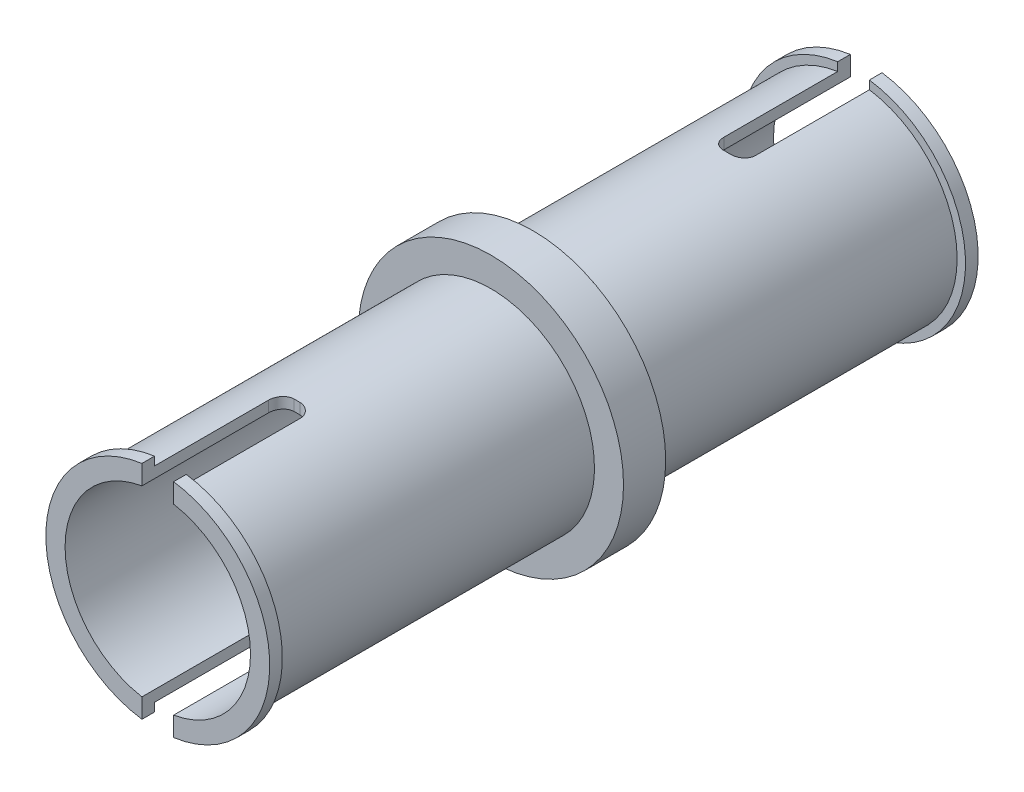
from build123d import *

# Parameters (mm, degrees)
BOSS_EXTRUDE1_DEPTH = 7.9
SKETCH2_R           = 3.144549921
BOSS_EXTRUDE3_DEPTH = 0.5
SKETCH3_R           = 2.455888386
BOSS_EXTRUDE4_DEPTH = 7.9
SKETCH4_R           = 2.65462565
BOSS_EXTRUDE5_DEPTH = 0.3
SKETCH5_R           = 2.198604039
CUT_EXTRUDE1_DEPTH  = 7.9
CUT_EXTRUDE2_DEPTH  = 3.3
FILLET1_R           = 0.3
CUT_EXTRUDE5_START  = 9
SKETCH7_R           = 3.144549921
CUT_EXTRUDE5_DEPTH  = 9


with BuildPart() as part:
    # Sketch1 → Boss-Extrude1 (new body)
    with BuildSketch(Plane.XY):
        Polygon((-2.4, 0.895), (-2.4, 0), (0, 0), (0, 2.4), (-0.9, 2.4), (-0.9, 0.895), align=None)
        Polygon((0, 0), (-2.4, 0), (-2.4, -0.895), (-0.9, -0.895), (-0.9, -2.4), (0, -2.4), align=None)
        Polygon((0, 2.4), (0, 0), (2.4, 0), (2.4, 0.895), (0.9, 0.895), (0.9, 2.4), align=None)
        Polygon((2.4, 0), (0, 0), (0, -2.4), (0.9, -2.4), (0.9, -0.895), (2.4, -0.895), align=None)
    extrude(amount=BOSS_EXTRUDE1_DEPTH)

    # Sketch2 → Boss-Extrude3 (add)
    with BuildSketch(Plane(origin=(0, 0, 0), x_dir=(-1, 0, 0), z_dir=(0, 0, -1))):
        Circle(SKETCH2_R)
    extrude(amount=BOSS_EXTRUDE3_DEPTH)

    # Sketch3 → Boss-Extrude4 (add)
    with BuildSketch(Plane(origin=(0, 0, -0.5), x_dir=(-1, 0, 0), z_dir=(0, 0, -1))):
        Circle(SKETCH3_R)
    extrude(amount=BOSS_EXTRUDE4_DEPTH)

    # Sketch4 → Boss-Extrude5 (add)
    with BuildSketch(Plane(origin=(0, 0, -8.4), x_dir=(-1, 0, 0), z_dir=(0, 0, -1))):
        Circle(SKETCH4_R)
    extrude(amount=-BOSS_EXTRUDE5_DEPTH)

    # Sketch5 → Cut-Extrude1 (cut)
    with BuildSketch(Plane(origin=(0, 0, -8.4), x_dir=(-1, 0, 0), z_dir=(0, 0, -1))):
        Circle(SKETCH5_R)
    extrude(amount=-CUT_EXTRUDE1_DEPTH, mode=Mode.SUBTRACT)

    # Sketch6 → Cut-Extrude2 (cut)
    with BuildSketch(Plane(origin=(0, 0, -8.4), x_dir=(-1, 0, 0), z_dir=(0, 0, -1))):
        with BuildLine():
            Line((0.375484044, 2.166303638), (0.375484044, 2.627936276))
            ThreePointArc((0.375484044, 2.627936276), (0.188215694, 2.6479449), (0, 2.65462565))
            Line((0, 2.65462565), (0, 2.198604039))
            ThreePointArc((0, 2.198604039), (0.188435389, 2.190514055), (0.375484044, 2.166303638))
        make_face()
        with BuildLine():
            Line((0, 2.198604039), (0, 2.65462565))
            ThreePointArc((0, 2.65462565), (-0.188215694, 2.6479449), (-0.375484044, 2.627936276))
            Line((-0.375484044, 2.627936276), (-0.375484044, 2.166303638))
            ThreePointArc((-0.375484044, 2.166303638), (-0.188435389, 2.190514055), (0, 2.198604039))
        make_face()
        with BuildLine():
            ThreePointArc((0, -2.65462565), (0.188215694, -2.6479449), (0.375484044, -2.627936276))
            Line((0.375484044, -2.627936276), (0.375484044, -2.166303638))
            ThreePointArc((0.375484044, -2.166303638), (0, -2.198604039), (-0.375484044, -2.166303638))
            Line((-0.375484044, -2.166303638), (-0.375484044, -2.627936276))
            ThreePointArc((-0.375484044, -2.627936276), (-0.188215694, -2.6479449), (0, -2.65462565))
        make_face()
    extrude(amount=-CUT_EXTRUDE2_DEPTH, mode=Mode.SUBTRACT)

    # Fillet1
    fillet1_edges = [part.edges().sort_by_distance(p)[0] for p in [
        (0.375484044, 2.296659081, -5.1),
        (-0.375484044, 2.296659081, -5.1),
        (-0.375484044, -2.296659081, -5.1),
        (0.375484044, -2.296659081, -5.1),
    ]]
    fillet(fillet1_edges, radius=FILLET1_R)

    # Sketch7 → Cut-Extrude5 (cut)
    with BuildSketch(Plane.XY.offset(CUT_EXTRUDE5_START)):
        with Locations(Location((0, 0, 0), (0, 0, 180))):
            Circle(SKETCH7_R)
    extrude(amount=-CUT_EXTRUDE5_DEPTH, mode=Mode.SUBTRACT)

    # Mirror3: part across face


with BuildPart() as part_1:
    add(part.part)
    add(part.part.mirror(Plane.XY))


solid = part_1.part
